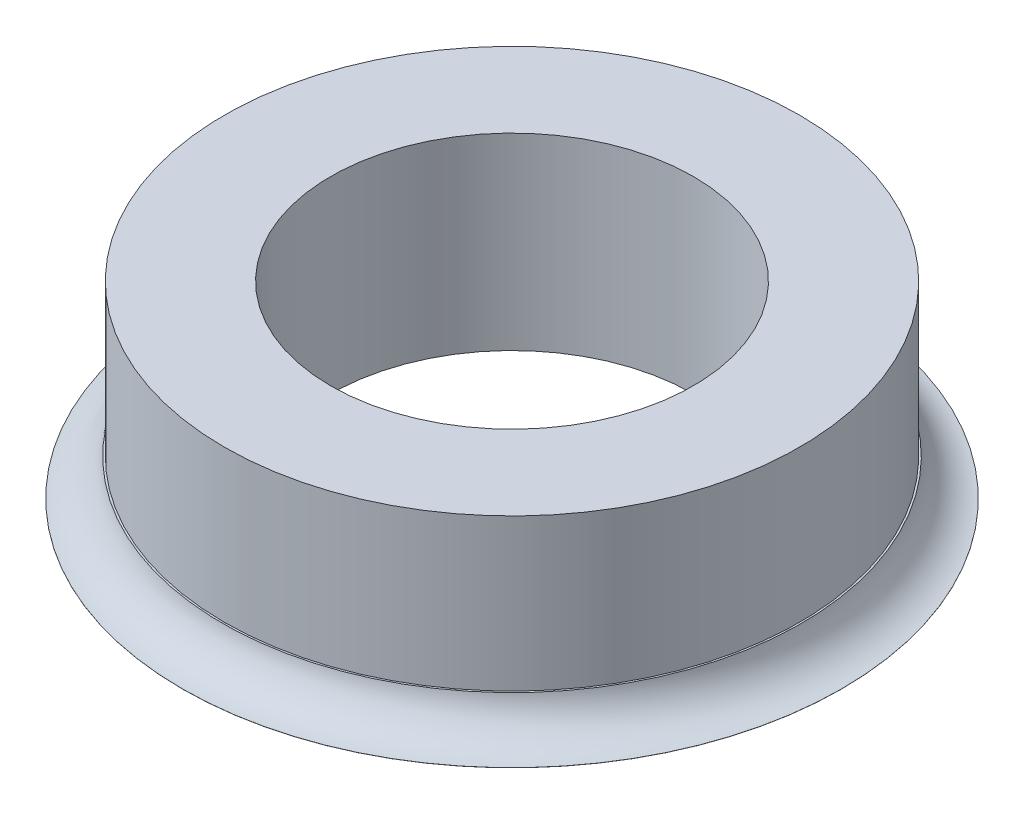
from build123d import *

# Parameters (mm, degrees)
SKETCH_1_R      = 3.925
SKETCH_1_R_2    = 2.475
EXTRUDE_1_DEPTH = 2.57
SKETCH_2_R      = 4.5
SKETCH_2_R_2    = 3.925
EXTRUDE_2_DEPTH = 0.5


with BuildPart() as part:
    # Эскиз1 → Бобышка-Вытянуть1 (new body)
    with BuildSketch(Plane(origin=(0, 0, 0), x_dir=(1, 0, 0), z_dir=(0, 1, 0))):
        with Locations(Location((0, 0, 0), (0, 0, 270))):
            Circle(SKETCH_1_R)
        with Locations(Location((0, 0, 0), (0, 0, 270))):
            Circle(SKETCH_1_R_2, mode=Mode.SUBTRACT)
    extrude(amount=EXTRUDE_1_DEPTH)

    # Эскиз2 → Бобышка-Вытянуть2 (add)
    with BuildSketch(Plane.XZ):
        with Locations(Location((0, 0, 0), (0, 0, 270))):
            Circle(SKETCH_2_R)
        with Locations(Location((0, 0, 0), (0, 0, 270))):
            Circle(SKETCH_2_R_2, mode=Mode.SUBTRACT)
    extrude(amount=-EXTRUDE_2_DEPTH)

    # Эскиз3 → Вырез-Повернуть1 (revolve, cut)
    with BuildSketch(Plane.XY, mode=Mode.PRIVATE) as cut_revolve_1_sk:
        with BuildLine():
            Line((-4.5, 0.001444425), (-4.5, 0.5))
            Line((-4.5, 0.5), (-3.95, 0.5))
            ThreePointArc((-3.95, 0.5), (-4.138643926, 0.15545532), (-4.5, 0.001444425))
        make_face()
    revolve(cut_revolve_1_sk.sketch.rotate(Axis((0, 0, 0), (0, 1, 0)), 270), axis=Axis((0, 0, 0), (0, 1, 0)), mode=Mode.SUBTRACT)


solid = part.part
